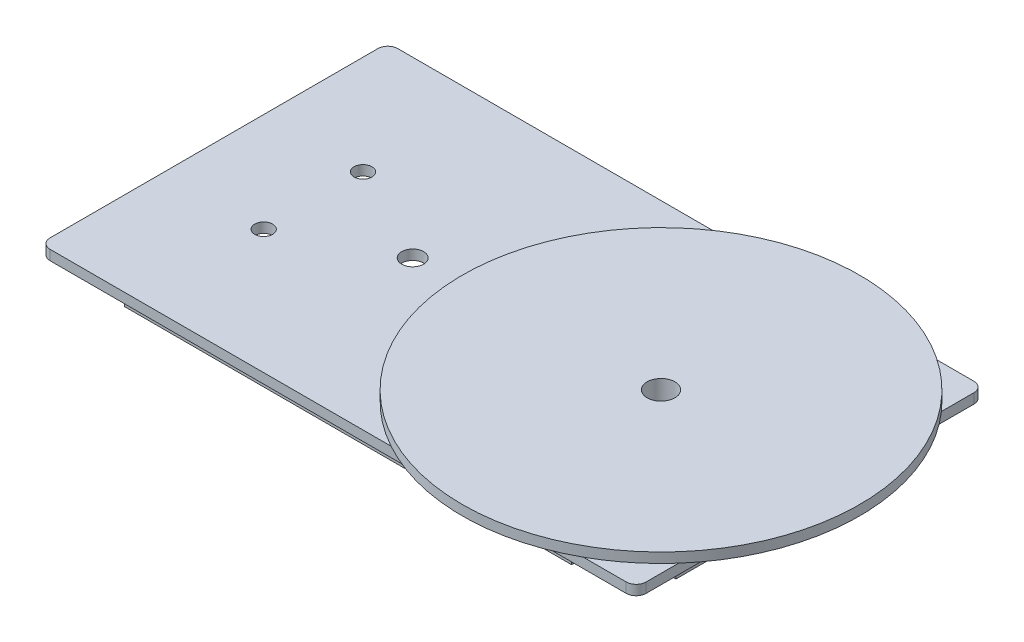
from build123d import *

# Parameters (mm, degrees)
SKETCH1_W           = 152.4
SKETCH1_H           = 88.9
BOSS_EXTRUDE1_DEPTH = 2.54
SKETCH2_W           = 2.54
SKETCH2_H           = 63.5
SKETCH2_W_2         = 114.3
SKETCH2_H_2         = 2.54
BOSS_EXTRUDE2_DEPTH = 3.175
FILLET1_R           = 2.54
SKETCH3_R           = 3.49631
SKETCH3_R_2         = 2.794
CUT_EXTRUDE1_DEPTH  = 2.54
SKETCH5_R           = 2.286
CUT_EXTRUDE2_DEPTH  = 89.401944125
SKETCH7_R           = 50.8
BOSS_EXTRUDE3_DEPTH = 2.54
SKETCH8_R           = 3.556
CUT_EXTRUDE3_DEPTH  = 103.722904092


with BuildPart() as part:
    # Sketch1 → Boss-Extrude1 (new body)
    with BuildSketch(Plane(origin=(0, 0, 0), x_dir=(1, 0, 0), z_dir=(0, 1, 0))):
        Rectangle(SKETCH1_W, SKETCH1_H)
    extrude(amount=BOSS_EXTRUDE1_DEPTH)

    # Sketch2 → Boss-Extrude2 (add)
    with BuildSketch(Plane.XZ):
        with Locations((-72.39, 0)):
            Rectangle(SKETCH2_W, SKETCH2_H)
        with Locations((72.39, 0)):
            Rectangle(SKETCH2_W, SKETCH2_H)
        with Locations((0, 40.64)):
            Rectangle(SKETCH2_W_2, SKETCH2_H_2)
        with Locations((0, -40.64)):
            Rectangle(SKETCH2_W_2, SKETCH2_H_2)
    extrude(amount=BOSS_EXTRUDE2_DEPTH)

    # Fillet1
    fillet1_edges = [part.edges().sort_by_distance(p)[0] for p in [
        (76.2, 1.27, 44.45),
        (-76.2, 1.27, 44.45),
        (-76.2, 1.27, -44.45),
        (76.2, 1.27, -44.45),
    ]]
    fillet(fillet1_edges, radius=FILLET1_R)

    # Sketch3 → Cut-Extrude1 (cut)
    with BuildSketch(Plane(origin=(0, 2.54, 0), x_dir=(1, 0, 0), z_dir=(0, 1, 0))):
        with Locations(Location((38.1, 0, 0), (0, 0, 270))):
            Circle(SKETCH3_R)
        with Locations(Location((-25.4, 0, 0), (0, 0, 270))):
            Circle(SKETCH3_R_2)
    extrude(amount=-CUT_EXTRUDE1_DEPTH, mode=Mode.SUBTRACT)

    # Sketch5 → Cut-Extrude2 (cut, through all)
    with BuildSketch(Plane(origin=(0, 2.54, 0), x_dir=(1, 0, 0), z_dir=(0, 1, 0))):
        with Locations(Location((-50.8, 12.7, 0), (0, 0, 270))):
            Circle(SKETCH5_R)
        with Locations(Location((-50.8, -12.7, 0), (0, 0, 90))):
            Circle(SKETCH5_R)
    extrude(amount=-CUT_EXTRUDE2_DEPTH, mode=Mode.SUBTRACT)

    # Sketch7 → Boss-Extrude3 (add)
    with BuildSketch(Plane(origin=(0, 2.54, 0), x_dir=(1, 0, 0), z_dir=(0, 1, 0))):
        with Locations(Location((38.1, 0, 0), (0, 0, 61.044975628))):
            Circle(SKETCH7_R)
    extrude(amount=BOSS_EXTRUDE3_DEPTH)

    # Sketch8 → Cut-Extrude3 (cut, through all)
    with BuildSketch(Plane(origin=(0, 5.08, 0), x_dir=(1, 0, 0), z_dir=(0, 1, 0))):
        with Locations(Location((38.1, 0, 0), (0, 0, 270))):
            Circle(SKETCH8_R)
    extrude(amount=-CUT_EXTRUDE3_DEPTH, mode=Mode.SUBTRACT)


solid = part.part
